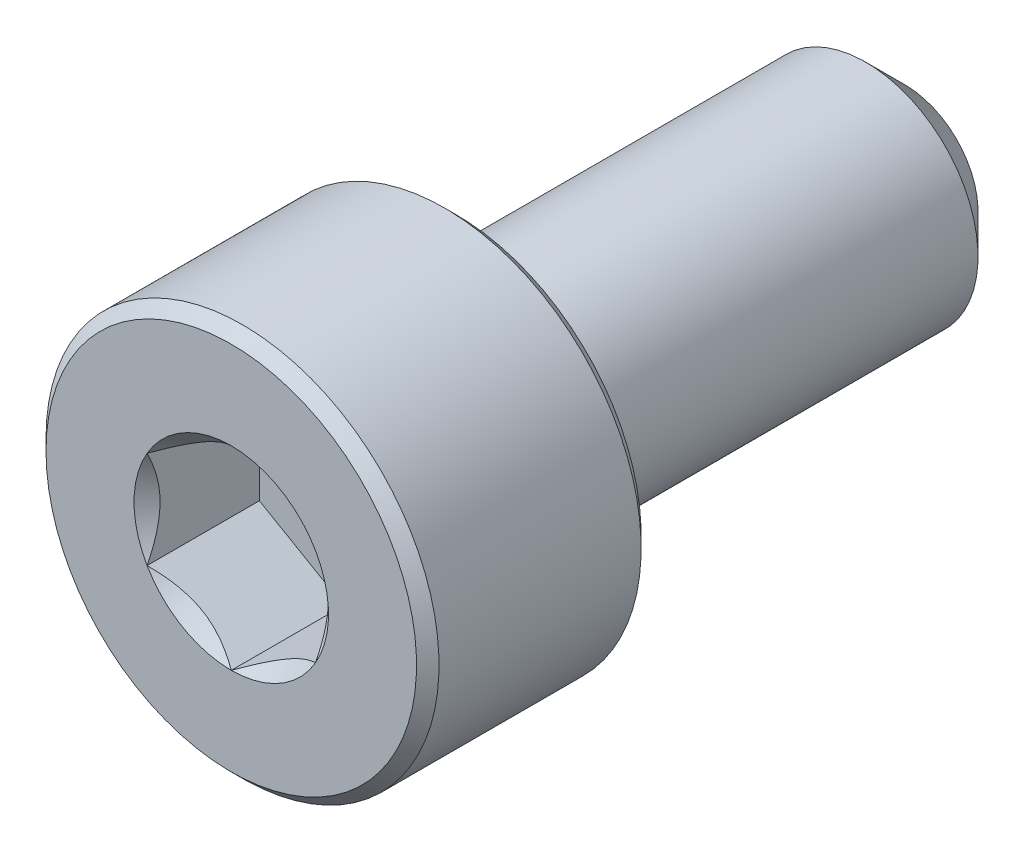
from build123d import *

# Parameters (mm, degrees)
CUT_EXTRUDE1_START = -2
CUT_EXTRUDE1_DEPTH = 2
SKETCH4_R          = 1.732050808
CUT_EXTRUDE2_DEPTH = 0.5
CUT_EXTRUDE2_DRAFT = -45


with BuildPart() as part:
    # Sketch2 → Revolve1 (revolve)
    with BuildSketch(Plane(origin=(0, 0, 0), x_dir=(0, 0, -1), z_dir=(1, 0, 0)), mode=Mode.PRIVATE) as revolve1_sk:
        Polygon((-5.8, 3.5), (-2.2, 3.5), (-2, 3.3), (-2, 2), (5.3, 2), (6, 1.3), (6, 0), (-6, 0), (-6, 3.3), align=None)
    revolve(revolve1_sk.sketch.rotate(Axis((0, 0, -6), (0, 0, 1)), 90), axis=Axis((0, 0, -6), (0, 0, 1)))

    # Sketch3 → Cut-Extrude1 (cut)
    with BuildSketch(Plane.XY.offset(6).offset(CUT_EXTRUDE1_START)):
        Polygon((0, 1.732050808), (-1.5, 0.866025404), (-1.5, -0.866025404), (0, -1.732050808), (1.5, -0.866025404), (1.5, 0.866025404), align=None)
    extrude(amount=CUT_EXTRUDE1_DEPTH, mode=Mode.SUBTRACT)


with BuildPart() as cut_extrude2_tool:
    # Sketch4 → Cut-Extrude2 (with draft: the straight prism first)
    with BuildSketch(Plane.XY.offset(6)):
        Circle(SKETCH4_R)
    extrude(amount=-CUT_EXTRUDE2_DEPTH)
    # Cut-Extrude2: the draft: its side faces are tilted about the plane it starts from
    cut_extrude2_sides = [cut_extrude2_tool.faces().sort_by_distance(p)[0] for p in [
        (-1.732050808, 0, 5.75),
    ]]
    draft(cut_extrude2_sides, Plane.XY.offset(6), CUT_EXTRUDE2_DRAFT)


with BuildPart() as part_1:
    add(part.part)

    # Cut-Extrude2: cut by cut_extrude2_tool
    add(cut_extrude2_tool.part, mode=Mode.SUBTRACT)


solid = part_1.part
